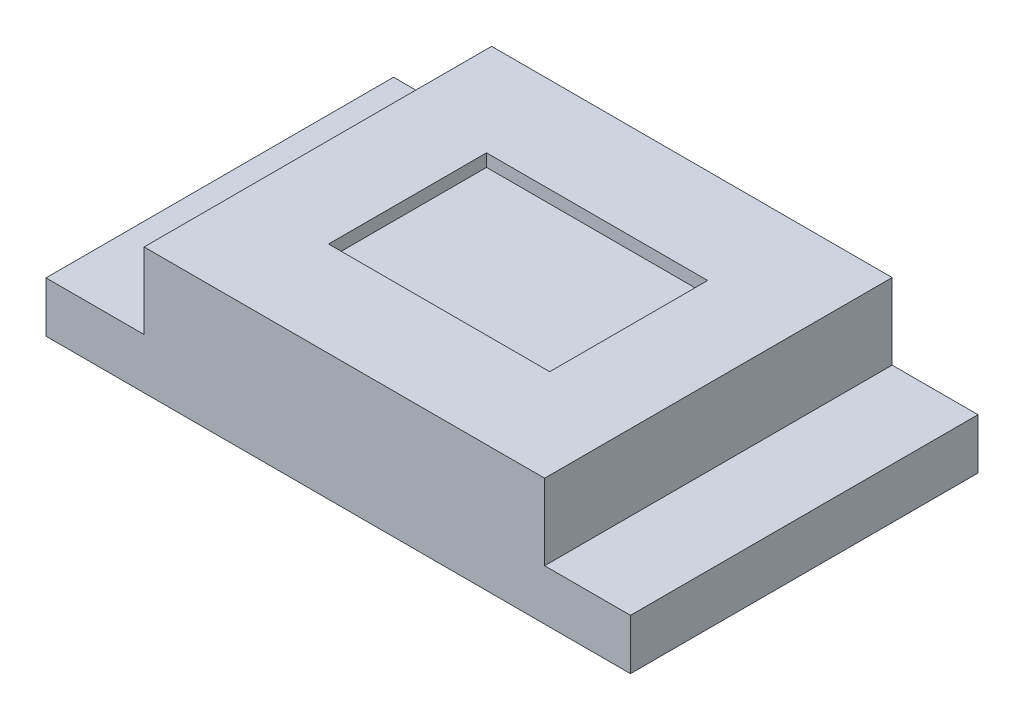
from build123d import *

# Parameters (mm, degrees)
SKETCH1_W           = 117.475
SKETCH1_H           = 69.85
BOSS_EXTRUDE1_DEPTH = 25.4
SKETCH2_W           = 19.716181521
SKETCH2_H           = 69.85
SKETCH2_W_2         = 17.25680248
CUT_EXTRUDE2_DEPTH  = 15.24
SKETCH3_W           = 44.45
SKETCH3_H           = 31.75
CUT_EXTRUDE4_DEPTH  = 2.54


with BuildPart() as part:
    # Sketch1 → Boss-Extrude1 (new body)
    with BuildSketch(Plane(origin=(0, 0, 0), x_dir=(1, 0, 0), z_dir=(0, 1, 0))):
        with Locations((58.7375, 34.925)):
            Rectangle(SKETCH1_W, SKETCH1_H)
    extrude(amount=BOSS_EXTRUDE1_DEPTH)

    # Sketch2 → Cut-Extrude2 (cut)
    with BuildSketch(Plane(origin=(0, 25.4, 0), x_dir=(1, 0, 0), z_dir=(0, 1, 0))):
        with Locations((9.858090761, 34.925)):
            Rectangle(SKETCH2_W, SKETCH2_H)
        with Locations((108.84659876, 34.925)):
            Rectangle(SKETCH2_W_2, SKETCH2_H)
    extrude(amount=-CUT_EXTRUDE2_DEPTH, mode=Mode.SUBTRACT)

    # Sketch3 → Cut-Extrude4 (cut)
    with BuildSketch(Plane(origin=(0, 25.4, 0), x_dir=(1, 0, 0), z_dir=(0, 1, 0))):
        with Locations((59.96718952, 34.925)):
            Rectangle(SKETCH3_W, SKETCH3_H)
    extrude(amount=-CUT_EXTRUDE4_DEPTH, mode=Mode.SUBTRACT)


solid = part.part
